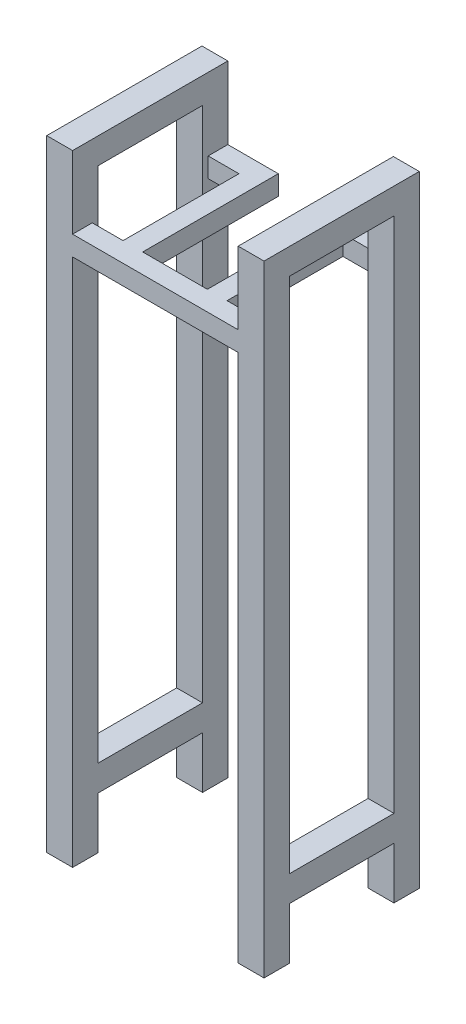
from build123d import *

# Parameters (mm, degrees)
BOSS_EXTRUDE5_DEPTH = 150
SKETCH6_W           = 101.090693468
SKETCH6_H           = 50
SKETCH6_H_2         = 500
CUT_EXTRUDE1_DEPTH  = 654.146231712
CUT_EXTRUDE2_REACH  = 655.146
SKETCH7_W           = 160
SKETCH7_H           = 150
SKETCH8_W           = 48.75
SKETCH8_H           = 19
BOSS_EXTRUDE6_DEPTH = 19
BOSS_EXTRUDE8_DEPTH = 19


with BuildPart() as part:
    # Sketch5 → Boss-Extrude5 (new body)
    with BuildSketch(Plane.XY):
        Polygon((0, 600), (0, 0), (25, 0), (25, 575), (185, 575), (185, 0), (210, 0), (210, 600), align=None)
    extrude(amount=BOSS_EXTRUDE5_DEPTH)

    # Sketch6 → Cut-Extrude1 (cut, through all)
    with BuildSketch(Plane.ZY):
        with Locations((75, 25)):
            Rectangle(SKETCH6_W, SKETCH6_H)
        with Locations((75, 325)):
            Rectangle(SKETCH6_W, SKETCH6_H_2)
    extrude(amount=-CUT_EXTRUDE1_DEPTH, mode=Mode.SUBTRACT)

    # Sketch7 → Cut-Extrude2 (cut, up to next)
    with BuildSketch(Plane(origin=(0, 600, 0), x_dir=(1, 0, 0), z_dir=(0, 1, 0)), mode=Mode.PRIVATE) as cut_extrude2_sk1:
        with Locations((105, -75)):
            Rectangle(SKETCH7_W, SKETCH7_H)
    cut_extrude2_tool1 = extrude(cut_extrude2_sk1.sketch, amount=-CUT_EXTRUDE2_REACH, mode=Mode.PRIVATE) & part.part
    add(cut_extrude2_tool1.solids().sort_by_distance((105, 600, 75))[0], mode=Mode.SUBTRACT)


with BuildPart() as cut_extrude2_piece_1:
    # of the separate pieces the step leaves, piece 1, a body of its own (cut_extrude2_pieces)
    add(part.part.solids().sort_by_distance((0, 600, 0))[0])

    # Sketch8 → Boss-Extrude6 (add)
    with BuildSketch(Plane(origin=(0, 0, 0), x_dir=(-1, 0, 0), z_dir=(0, 0, -1))):
        with Locations((-160.625, 520.5)):
            Rectangle(SKETCH8_W, SKETCH8_H)
        with Locations((-49.375, 520.5)):
            Rectangle(SKETCH8_W, SKETCH8_H)
    extrude(amount=-BOSS_EXTRUDE6_DEPTH)


with BuildPart() as cut_extrude2_piece_2:
    # of the separate pieces the step leaves, piece 2, a body of its own (cut_extrude2_pieces)
    add(part.part.solids().sort_by_distance((210, 600, 0))[0])



with BuildPart() as boss_extrude6_piece_1:
    # of the separate pieces the step leaves, piece 1, a body of its own (boss_extrude6_pieces)
    add(cut_extrude2_piece_1.part.solids().sort_by_distance((0, 600, 0))[0])


with BuildPart() as boss_extrude6_piece_2:
    # of the separate pieces the step leaves, piece 2, a body of its own (boss_extrude6_pieces)
    add(cut_extrude2_piece_1.part.solids().sort_by_distance((136.25, 530, 0))[0])


with BuildPart() as cut_extrude2_piece_2_1:
    add(cut_extrude2_piece_2.part)

    add(boss_extrude6_piece_1.part)  # Boss-Extrude8 merges Boss-Extrude6 piece 1

    add(boss_extrude6_piece_2.part)  # Boss-Extrude8 merges Boss-Extrude6 piece 2
    # Sketch10 → Boss-Extrude8 (add)
    with BuildSketch(Plane(origin=(0, 530, 0), x_dir=(1, 0, 0), z_dir=(0, 1, 0))):
        Polygon((185, -150), (25, -150), (25, -131), (54.75, -131), (54.75, -19), (73.75, -19), (73.75, -131), (136.25, -131), (136.25, -19), (155.25, -19), (155.25, -131), (185, -131), align=None)
    extrude(amount=-BOSS_EXTRUDE8_DEPTH)


solid = cut_extrude2_piece_2_1.part
